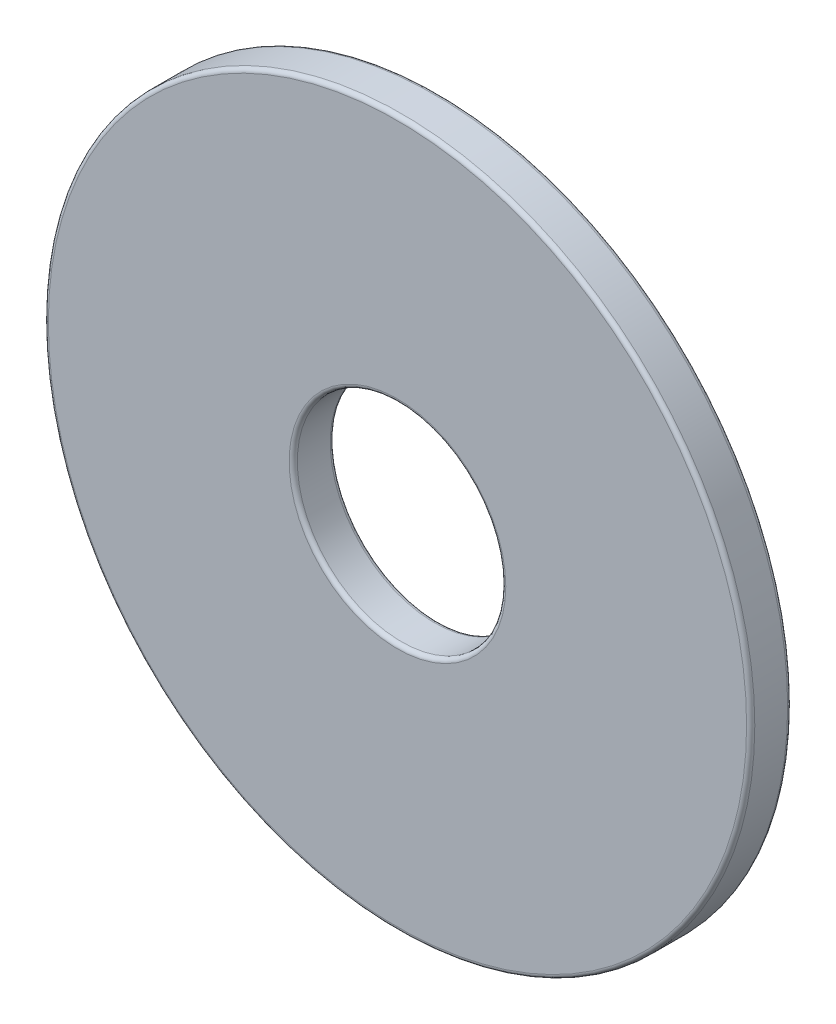
from build123d import *

# Parameters (mm, degrees)
BOSS_EXTRUDE1_START = 0.508
SKETCH3_R           = 8.7376
SKETCH3_R_2         = 2.5781
BOSS_EXTRUDE1_DEPTH = 1.016
FILLET1_R           = 0.1016


with BuildPart() as part:
    # Sketch3 → Boss-Extrude1 (new body)
    with BuildSketch(Plane.XY.offset(BOSS_EXTRUDE1_START)):
        Circle(SKETCH3_R)
        Circle(SKETCH3_R_2, mode=Mode.SUBTRACT)
    extrude(amount=-BOSS_EXTRUDE1_DEPTH)

    # Fillet1
    fillet1_edges = [part.edges().sort_by_distance(p)[0] for p in [
        (-8.7376, 0, 0.508),
        (-8.7376, 0, -0.508),
        (-2.5781, 0, -0.508),
        (-2.5781, 0, 0.508),
    ]]
    fillet(fillet1_edges, radius=FILLET1_R)


solid = part.part
